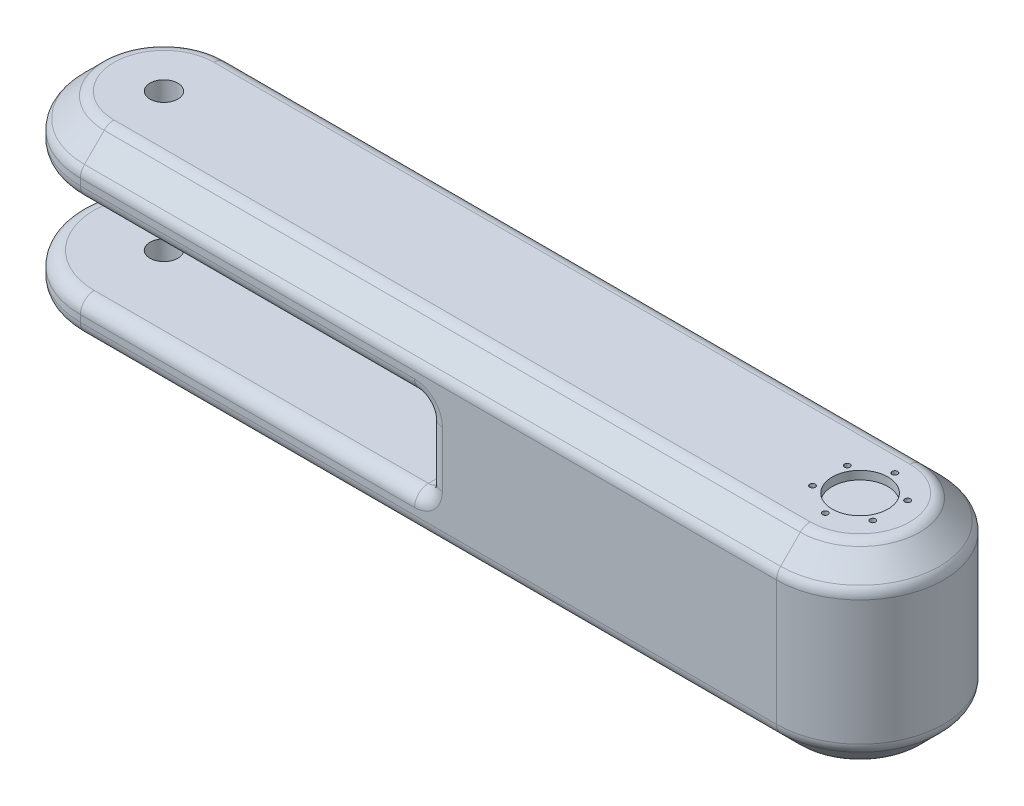
from build123d import *

# Parameters (mm, degrees)
BOSS_EXTRUDE1_DEPTH = 34.5
SKETCH2_R           = 10
CUT_EXTRUDE1_DEPTH  = 3
CUT_EXTRUDE2_START  = -3
SKETCH4_R           = 10
CUT_EXTRUDE2_DEPTH  = 3
CHAMFER1_SIZE       = 10
FILLET1_R           = 5
SKETCH5_W           = 125
SKETCH5_H           = 30
SKETCH5_W_2         = 30
CUT_EXTRUDE3_DEPTH  = 170.750539354
FILLET2_R           = 5
SKETCH6_R           = 5
CUT_EXTRUDE4_DEPTH  = 173.296256596
CIRPATTERN1_COUNT   = 6
CIRPATTERN2_COUNT   = 6


with BuildPart() as part:
    # Sketch1 → Boss-Extrude1 (new, symmetric)
    with BuildSketch(Plane(origin=(0, 0, 0), x_dir=(1, 0, 0), z_dir=(0, 1, 0))):
        with BuildLine():
            Line((-125, 30), (125, 30))
            ThreePointArc((125, 30), (155, 0), (125, -30))
            Line((125, -30), (-125, -30))
            ThreePointArc((-125, -30), (-155, 0), (-125, 30))
        make_face()
    extrude(amount=BOSS_EXTRUDE1_DEPTH, both=True)

    # Sketch2 → Cut-Extrude1 (cut)
    with BuildSketch(Plane(origin=(0, 34.5, 0), x_dir=(1, 0, 0), z_dir=(0, 1, 0))):
        with Locations(Location((125, 0, 0), (0, 0, 270))):
            Circle(SKETCH2_R)
    extrude(amount=-CUT_EXTRUDE1_DEPTH, mode=Mode.SUBTRACT)

    # Sketch4 → Cut-Extrude2 (cut)
    with BuildSketch(Plane.XZ.offset(34.5).offset(CUT_EXTRUDE2_START)):
        with Locations(Location((125, 0, 0), (0, 0, 90))):
            Circle(SKETCH4_R)
    extrude(amount=CUT_EXTRUDE2_DEPTH, mode=Mode.SUBTRACT)

    # Chamfer1
    chamfer1_edges = [part.edges().sort_by_distance(p)[0] for p in [
        (155, 34.5, 0),
        (0, 34.5, -30),
        (-155, 34.5, 0),
        (0, -34.5, -30),
        (155, -34.5, 0),
        (0, -34.5, 30),
        (-155, -34.5, 0),
        (0, 34.5, 30),
    ]]
    chamfer(chamfer1_edges, length=CHAMFER1_SIZE)

    # Fillet1
    fillet1_edges = [part.edges().sort_by_distance(p)[0] for p in [
        (0, 24.5, -30),
        (0, -24.5, -30),
        (0, -34.5, 20),
        (145, -34.5, 0),
        (-145, -34.5, 0),
        (0, -34.5, -20),
        (-155, 24.5, 0),
        (-155, -24.5, 0),
        (155, 24.5, 0),
        (155, -24.5, 0),
        (0, 24.5, 30),
        (0, -24.5, 30),
        (0, 34.5, 20),
        (145, 34.5, 0),
        (-145, 34.5, 0),
        (0, 34.5, -20),
    ]]
    fillet(fillet1_edges, radius=FILLET1_R)

    # Sketch5 → Cut-Extrude3 (cut, through all)
    with BuildSketch(Plane(origin=(0, 0, -30), x_dir=(-1, 0, 0), z_dir=(0, 0, -1))):
        with Locations((62.5, 0)):
            Rectangle(SKETCH5_W, SKETCH5_H)
        with Locations((140, 0)):
            Rectangle(SKETCH5_W_2, SKETCH5_H)
    extrude(amount=-CUT_EXTRUDE3_DEPTH, mode=Mode.SUBTRACT)

    # Fillet2
    fillet2_edges = [part.edges().sort_by_distance(p)[0] for p in [
        (-62.5, 15, -30),
        (-62.5, -15, 30),
        (-155, -15, 0),
        (-155, 15, 0),
        (-62.5, 15, 30),
        (0, 15, 0),
        (0, 0, 30),
        (0, -15, 0),
        (0, 0, -30),
        (-62.5, -15, -30),
    ]]
    fillet(fillet2_edges, radius=FILLET2_R)

    # Sketch6 → Cut-Extrude4 (cut, through all)
    with BuildSketch(Plane.XZ.offset(34.5)):
        with Locations(Location((-125, 0, 0), (0, 0, 270))):
            Circle(SKETCH6_R)
    extrude(amount=-CUT_EXTRUDE4_DEPTH, mode=Mode.SUBTRACT)

    # Sketch8 → Ø2.0mm Dowel Hole1 (revolve, cut)
    with BuildSketch(Plane(origin=(125, 34.5, -12.5), x_dir=(0, 0, 1), z_dir=(1, 0, 0))):
        Polygon((0, 0), (0, 5.600860619), (1, 5), (1, 0), align=None)
    f_2_0mm_dowel_hole1 = revolve(axis=Axis((125, 40.85, -12.5), (0, -1, 0)), mode=Mode.SUBTRACT)

    # CirPattern1: Ø2.0mm Dowel Hole1 ×6 about axis
    cirpattern1_axis = Axis((125, 0, 0), (0, 1, 0))
    for i in range(1, CIRPATTERN1_COUNT):
        add(f_2_0mm_dowel_hole1.rotate(cirpattern1_axis, i * 360 / CIRPATTERN1_COUNT), mode=Mode.SUBTRACT)

    # Sketch10 → Ø2.0mm Dowel Hole2 (revolve, cut)
    with BuildSketch(Plane(origin=(125, -34.5, 12.5), x_dir=(0, 0, -1), z_dir=(1, 0, 0))):
        Polygon((0, 0), (0, 5.600860619), (1, 5), (1, 0), align=None)
    f_2_0mm_dowel_hole2 = revolve(axis=Axis((125, -40.85, 12.5), (0, 1, 0)), mode=Mode.SUBTRACT)

    # CirPattern2: Ø2.0mm Dowel Hole2 ×6 about axis
    cirpattern2_axis = Axis((125, 0, 0), (0, 1, 0))
    for i in range(1, CIRPATTERN2_COUNT):
        add(f_2_0mm_dowel_hole2.rotate(cirpattern2_axis, i * 360 / CIRPATTERN2_COUNT), mode=Mode.SUBTRACT)


solid = part.part
